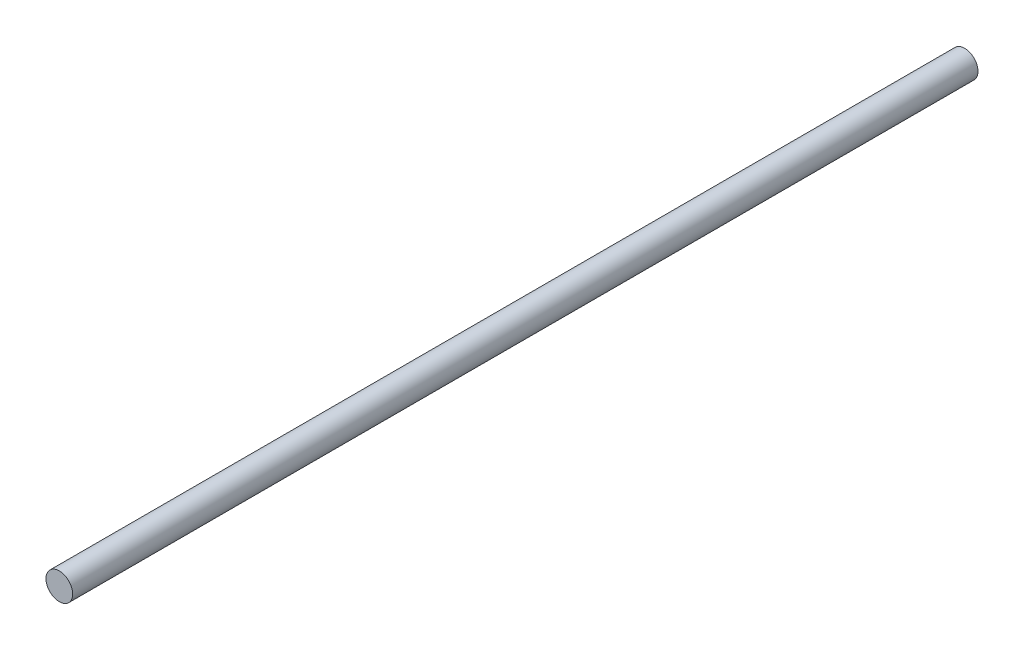
from build123d import *

# Parameters (mm, degrees)
CURVESKETCH_R   = 0.173
CURVEBOSS_DEPTH = 11.731


with BuildPart() as part:
    # CurveSketch → CurveBoss (new body)
    with BuildSketch(Plane.XY):
        with Locations((-3.719, 5.173)):
            Circle(CURVESKETCH_R)
    extrude(amount=CURVEBOSS_DEPTH)


solid = part.part
